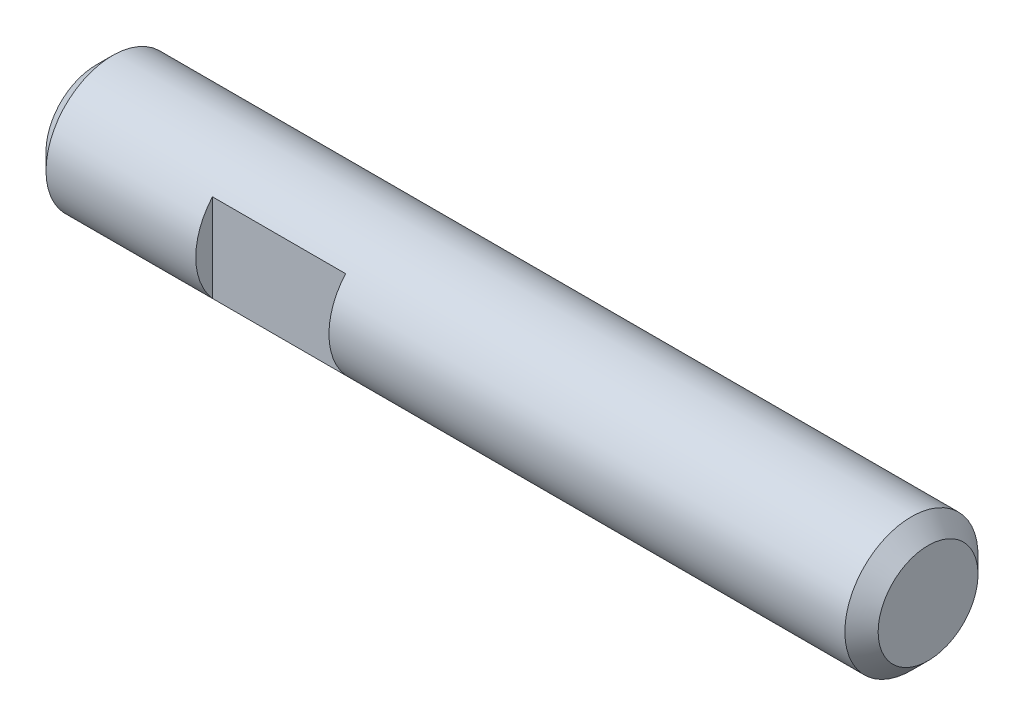
from build123d import *

# Parameters (mm, degrees)
ENL_V_MAT_EXTRU_1_DEPTH      = 4
ENL_V_MAT_EXTRU_1_DEPTH_BACK = 4
ESQUISSE2_W                  = 4
ESQUISSE2_H                  = 0.5


with BuildPart() as part:
    # Esquisse1 → Révolution1 (revolve)
    with BuildSketch(Plane.XY):
        Polygon((0, 0), (0, 1.5), (0.5, 2), (24.5, 2), (25, 1.5), (25, 0), align=None)
    revolve(axis=Axis((25, 0, 0), (-1, 0, 0)))

    # Esquisse2 → Enlèv. mat.-Extru.1 (cut, two sides: drawn at the far end of the back side and taken through both)
    with BuildSketch(Plane(origin=(0, 0, 0), x_dir=(1, 0, 0), z_dir=(0, 1, 0)).offset(-ENL_V_MAT_EXTRU_1_DEPTH_BACK)):
        with Locations((7, -1.75)):
            Rectangle(ESQUISSE2_W, ESQUISSE2_H)
    extrude(amount=ENL_V_MAT_EXTRU_1_DEPTH + ENL_V_MAT_EXTRU_1_DEPTH_BACK, mode=Mode.SUBTRACT)


solid = part.part
